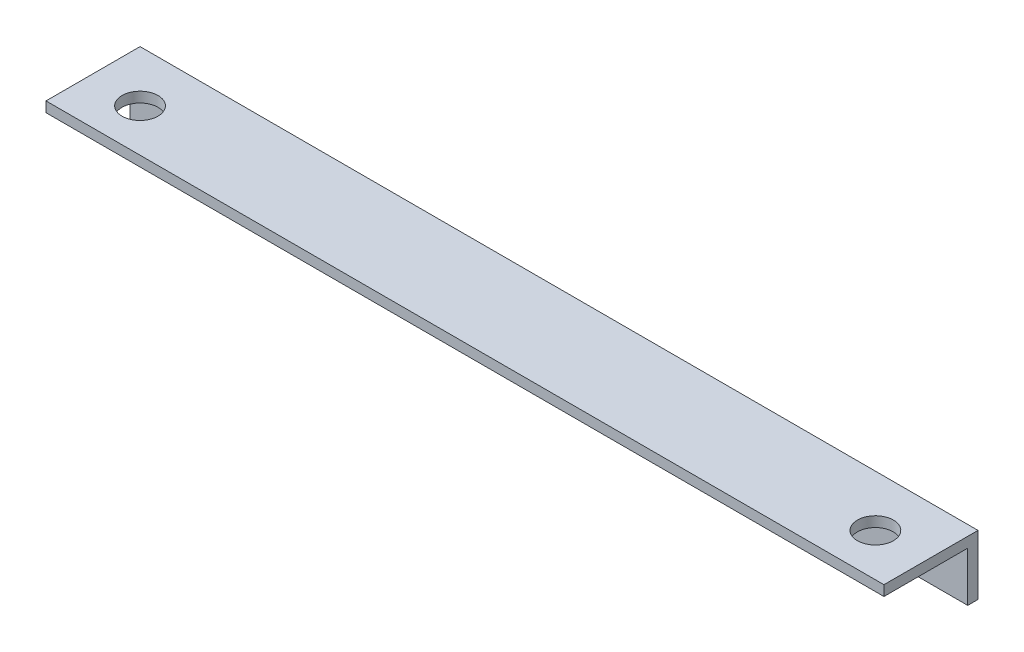
from build123d import *

# Parameters (mm, degrees)
SKETCH1_W           = 98
SKETCH1_H           = 7
SKETCH1_R           = 1.6
BOSS_EXTRUDE1_DEPTH = 1.2
SKETCH2_W           = 98
SKETCH2_H           = 9.8
SKETCH2_R           = 2.1
BOSS_EXTRUDE2_DEPTH = 1.2


with BuildPart() as part:
    # Sketch1 → Boss-Extrude1 (new body)
    with BuildSketch(Plane.XY):
        Rectangle(SKETCH1_W, SKETCH1_H)
        with Locations((-35, -0.7)):
            Circle(SKETCH1_R, mode=Mode.SUBTRACT)
        with Locations(Location((35, -0.7, 0), (0, 0, 180))):
            Circle(SKETCH1_R, mode=Mode.SUBTRACT)
    extrude(amount=BOSS_EXTRUDE1_DEPTH)

    # Sketch2 → Boss-Extrude2 (add)
    with BuildSketch(Plane(origin=(0, 3.5, 0), x_dir=(1, 0, 0), z_dir=(0, 1, 0))):
        with Locations((0, -6.1)):
            Rectangle(SKETCH2_W, SKETCH2_H)
        with Locations(Location((-43, -6, 0), (0, 0, 270))):
            Circle(SKETCH2_R, mode=Mode.SUBTRACT)
        with Locations(Location((43, -6, 0), (0, 0, 90))):
            Circle(SKETCH2_R, mode=Mode.SUBTRACT)
    extrude(amount=-BOSS_EXTRUDE2_DEPTH)


solid = part.part
